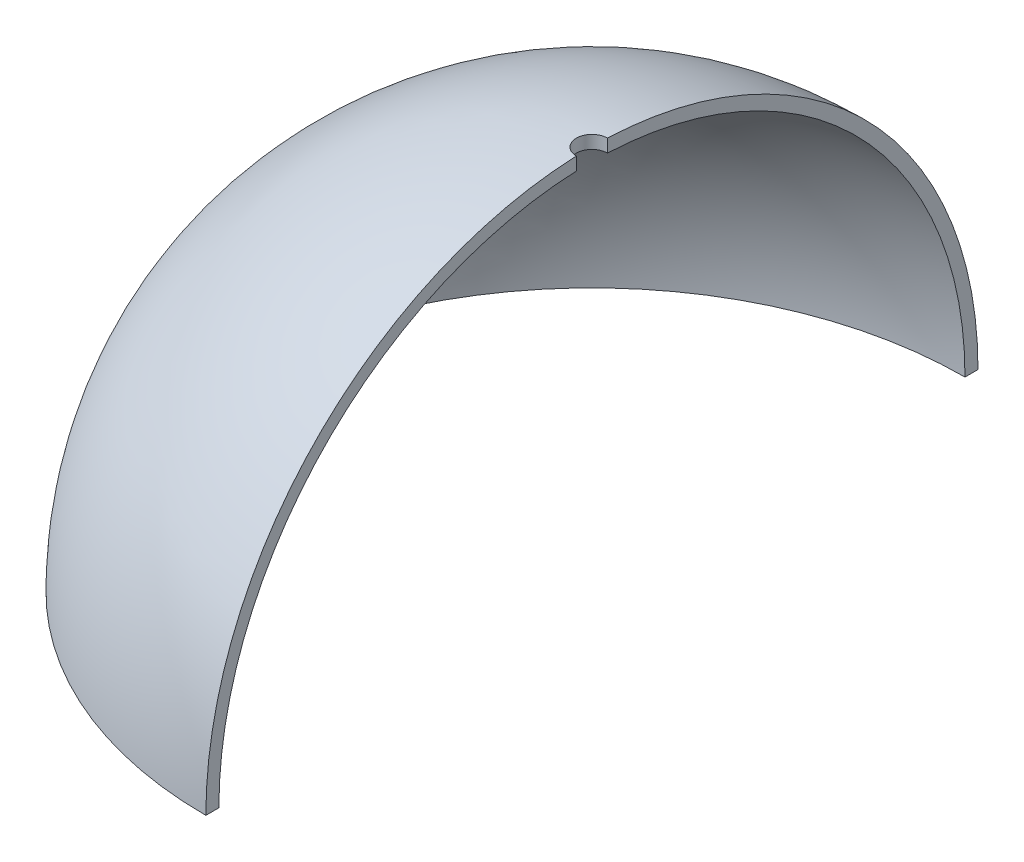
from build123d import *

# Parameters (mm, degrees)
REVOLVE1_ANGLE          = 90
CUT_EXTRUDE1_REACH      = 17227.245
CUT_EXTRUDE1_END_RADIUS = 9945
SKETCH3_R               = 400


with BuildPart() as part:
    # Sketch2 → Revolve1 (revolve)
    with BuildSketch(Plane(origin=(0, 0, 0), x_dir=(1, 0, 0), z_dir=(0, 1, 0))):
        with BuildLine():
            Line((0, -9945), (0, -9610))
            ThreePointArc((0, -9610), (-9610, 0), (0, 9610))
            Line((0, 9610), (0, 9945))
            ThreePointArc((0, 9945), (-9945, 0), (0, -9945))
        make_face()
    revolve(axis=Axis((0, 0, 3077.152585208), (0, 0, -1)), revolution_arc=REVOLVE1_ANGLE)

    # Cut-Extrude1: up to this sphere (the profile starts inside it)
    cut_extrude1_end = Location((0, 0, 0)) * Sphere(CUT_EXTRUDE1_END_RADIUS, mode=Mode.PRIVATE)
    # Sketch3 → Cut-Extrude1 (cut, up to the surface)
    with BuildSketch(Plane(origin=(0, 0, 0), x_dir=(1, 0, 0), z_dir=(0, 1, 0)), mode=Mode.PRIVATE) as cut_extrude1_sk1:
        Circle(SKETCH3_R)
    cut_extrude1_tool1 = extrude(cut_extrude1_sk1.sketch, amount=CUT_EXTRUDE1_REACH, mode=Mode.PRIVATE) & cut_extrude1_end
    add(cut_extrude1_tool1.solids().sort_by_distance((0, 0, 0))[0], mode=Mode.SUBTRACT)


solid = part.part
